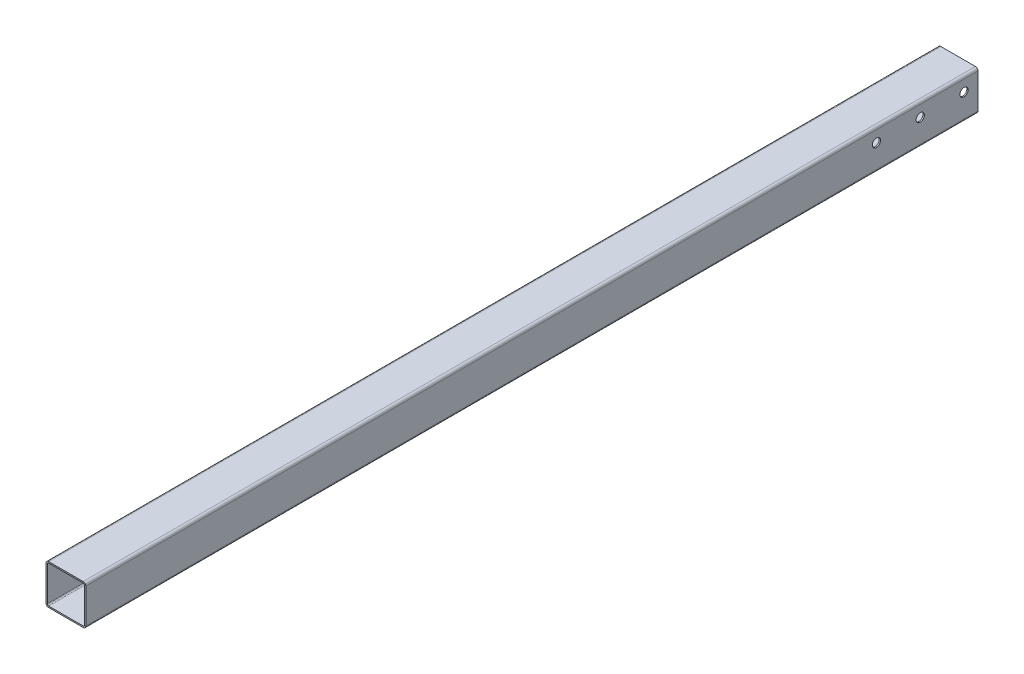
from build123d import *

# Parameters (mm, degrees)
BOSS_EXTRUDE1_DEPTH     = 1422.4
F_1_2_CLEARANCE_HOLE1_D = 13.09624


with BuildPart() as part:
    # Sketch1 → Boss-Extrude1 (new body)
    with BuildSketch(Plane.XY):
        with BuildLine():
            Line((27.5336, 31.75), (-27.5336, 31.75))
            ThreePointArc((-27.5336, 31.75), (-30.515045032, 30.515045032), (-31.75, 27.5336))
            Line((-31.75, 27.5336), (-31.75, -27.5336))
            ThreePointArc((-31.75, -27.5336), (-30.515045032, -30.515045032), (-27.5336, -31.75))
            Line((-27.5336, -31.75), (27.5336, -31.75))
            ThreePointArc((27.5336, -31.75), (30.515045032, -30.515045032), (31.75, -27.5336))
            Line((31.75, -27.5336), (31.75, 27.5336))
            ThreePointArc((31.75, 27.5336), (30.515045032, 30.515045032), (27.5336, 31.75))
        make_face()
        with BuildLine():
            Line((27.5336, 29.6418), (-27.5336, 29.6418))
            ThreePointArc((-27.5336, 29.6418), (-29.024322516, 29.024322516), (-29.6418, 27.5336))
            Line((-29.6418, 27.5336), (-29.6418, -27.5336))
            ThreePointArc((-29.6418, -27.5336), (-29.024322516, -29.024322516), (-27.5336, -29.6418))
            Line((-27.5336, -29.6418), (27.5336, -29.6418))
            ThreePointArc((27.5336, -29.6418), (29.024322516, -29.024322516), (29.6418, -27.5336))
            Line((29.6418, -27.5336), (29.6418, 27.5336))
            ThreePointArc((29.6418, 27.5336), (29.024322516, 29.024322516), (27.5336, 29.6418))
        make_face(mode=Mode.SUBTRACT)
    extrude(amount=BOSS_EXTRUDE1_DEPTH)

    # 1/2 Clearance Hole1 (through all)
    with Locations(Plane(origin=(31.75, 9.525, 22.225), x_dir=(0, 0, 1), z_dir=(1, 0, 0))):
        with Locations((0, 0), (69.85, 0), (139.7, 0)):
            Hole(F_1_2_CLEARANCE_HOLE1_D / 2)


solid = part.part
